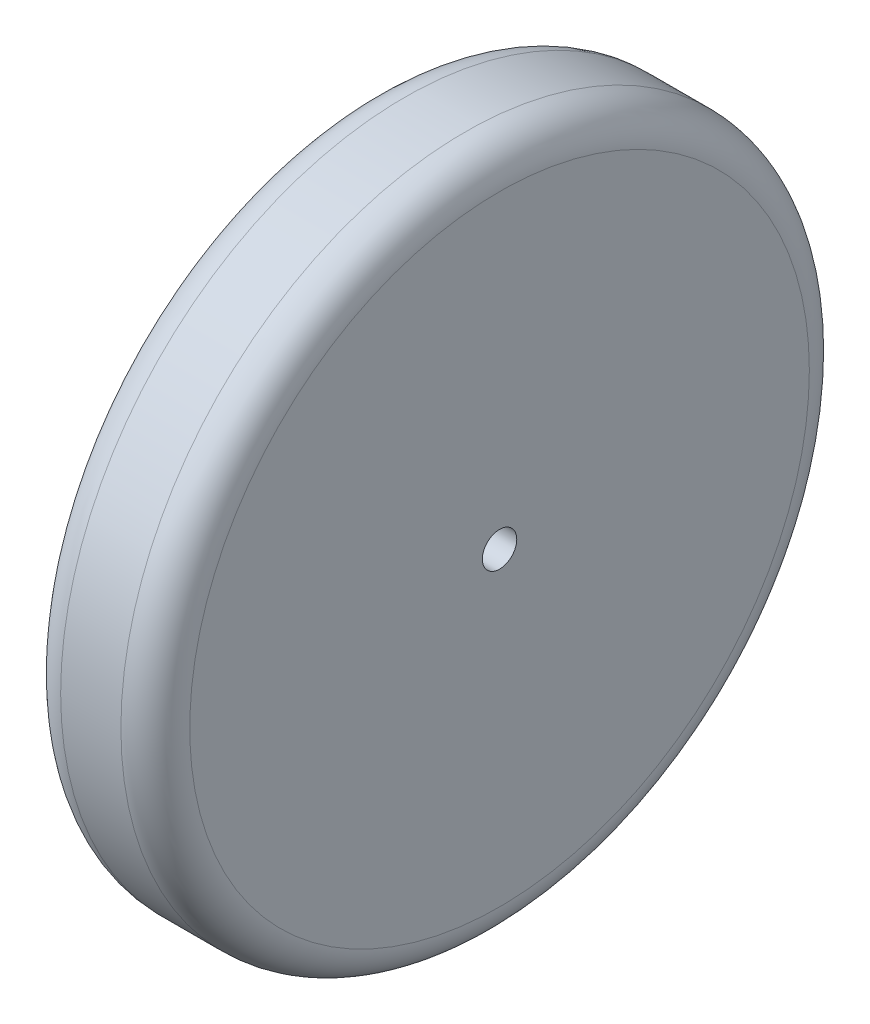
from build123d import *

# Parameters (mm, degrees)
SKETCH1_R           = 200
SKETCH1_R_2         = 10
BOSS_EXTRUDE1_DEPTH = 37.5
FILLET1_R           = 20


with BuildPart() as part:
    # Sketch1 → Boss-Extrude1 (new, symmetric)
    with BuildSketch(Plane(origin=(0, 0, 0), x_dir=(0, 0, -1), z_dir=(1, 0, 0))):
        Circle(SKETCH1_R)
        Circle(SKETCH1_R_2, mode=Mode.SUBTRACT)
    extrude(amount=BOSS_EXTRUDE1_DEPTH, both=True)

    # Fillet1
    fillet1_edges = [part.edges().sort_by_distance(p)[0] for p in [
        (-37.5, 0, 200),
        (37.5, 0, 200),
    ]]
    fillet(fillet1_edges, radius=FILLET1_R)


solid = part.part
